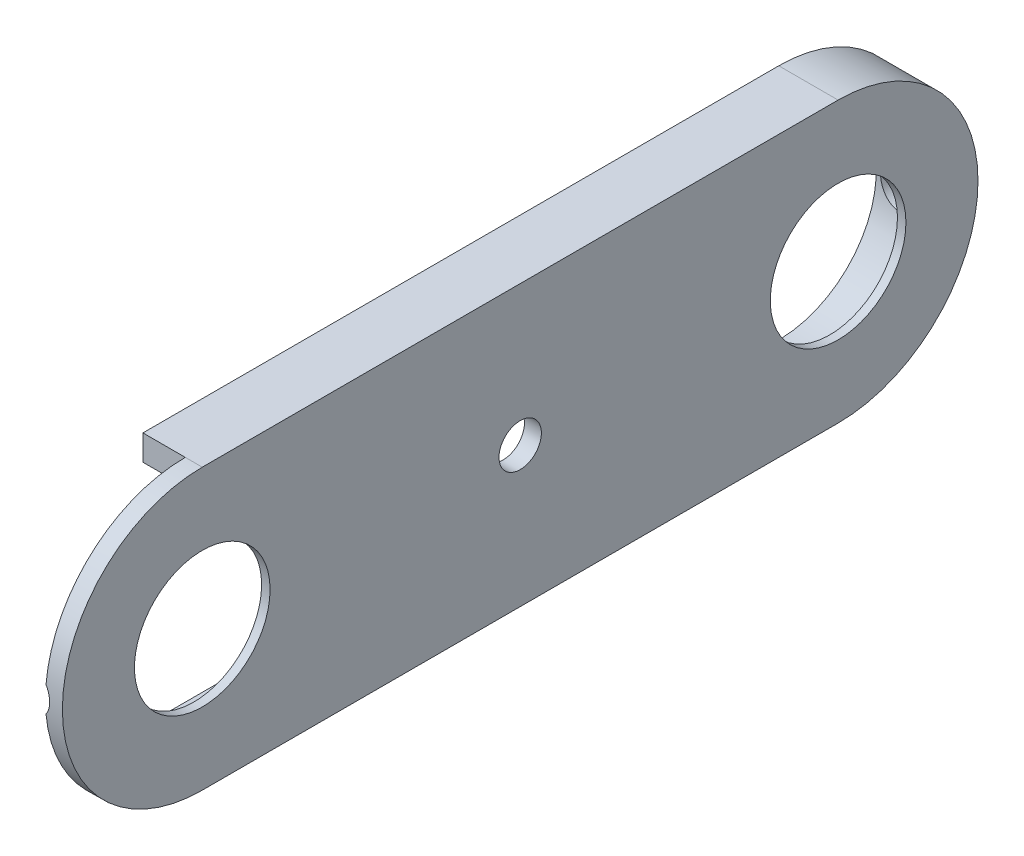
from build123d import *

# Parameters (mm, degrees)
SKETCH3_R           = 11.5
BOSS_EXTRUDE2_DEPTH = 1
BOSS_EXTRUDE3_START = 1
SKETCH4_R           = 8
BOSS_EXTRUDE3_DEPTH = 1
SKETCH5_R           = 11.5
BOSS_EXTRUDE4_DEPTH = 5
SKETCH6_R           = 2.5
CUT_EXTRUDE1_DEPTH  = 10
SKETCH7_R           = 2.5
CUT_EXTRUDE2_DEPTH  = 57.896836604
SKETCH11_W          = 5
SKETCH11_H          = 75
BOSS_EXTRUDE7_DEPTH = 3


with BuildPart() as part:
    # Sketch3 → Boss-Extrude2 (new body)
    with BuildSketch(Plane(origin=(0, 20, 0), x_dir=(0, 1, 0), z_dir=(-1, 0, 0))):
        with BuildLine():
            Line((-3.5, 37.5), (-3.5, -37.5))
            ThreePointArc((-3.5, -37.5), (-20, -54), (-36.5, -37.5))
            Line((-36.5, -37.5), (-36.5, 37.5))
            ThreePointArc((-36.5, 37.5), (-20, 54), (-3.5, 37.5))
        make_face()
        with Locations(Location((-20, -37.5, 0), (0, 0, 270))):
            Circle(SKETCH3_R, mode=Mode.SUBTRACT)
        with Locations(Location((-20, 37.5, 0), (0, 0, 270))):
            Circle(SKETCH3_R, mode=Mode.SUBTRACT)
    extrude(amount=BOSS_EXTRUDE2_DEPTH)

    # Sketch4 → Boss-Extrude3 (add)
    with BuildSketch(Plane(origin=(0, 0, 0), x_dir=(0, 0, -1), z_dir=(1, 0, 0)).offset(BOSS_EXTRUDE3_START)):
        with BuildLine():
            Line((37.5, 16.5), (-37.5, 16.5))
            ThreePointArc((-37.5, 16.5), (-54, 0), (-37.5, -16.5))
            Line((-37.5, -16.5), (37.5, -16.5))
            ThreePointArc((37.5, -16.5), (54, 0), (37.5, 16.5))
        make_face()
        with Locations((-37.5, 0)):
            Circle(SKETCH4_R, mode=Mode.SUBTRACT)
        with Locations((37.5, 0)):
            Circle(SKETCH4_R, mode=Mode.SUBTRACT)
    extrude(amount=-BOSS_EXTRUDE3_DEPTH)

    # Sketch5 → Boss-Extrude4 (add)
    with BuildSketch(Plane.ZY.offset(1)):
        with BuildLine():
            ThreePointArc((-37.5, 16.5), (-54, 0), (-37.5, -16.5))
            ThreePointArc((-37.5, -16.5), (-21, 0), (-37.5, 16.5))
        make_face()
        with Locations((-37.5, 0)):
            Circle(SKETCH5_R, mode=Mode.SUBTRACT)
    extrude(amount=BOSS_EXTRUDE4_DEPTH)

    # Sketch6 → Cut-Extrude1 (cut)
    with BuildSketch(Plane.XY.offset(54)):
        with Locations((-3, 0)):
            Circle(SKETCH6_R)
    cut_extrude1 = extrude(amount=-CUT_EXTRUDE1_DEPTH, mode=Mode.SUBTRACT)

    # Mirror1: Cut-Extrude1 across plane
    add(cut_extrude1.mirror(Plane.XY), mode=Mode.SUBTRACT)

    # Sketch7 → Cut-Extrude2 (cut, through all)
    with BuildSketch(Plane(origin=(1, 0, 0), x_dir=(0, 0, -1), z_dir=(1, 0, 0))):
        Circle(SKETCH7_R)
    extrude(amount=-CUT_EXTRUDE2_DEPTH, mode=Mode.SUBTRACT)

    # Sketch11 → Boss-Extrude7 (add)
    with BuildSketch(Plane.XZ.offset(16.5)):
        with Locations((-3.5, 0)):
            Rectangle(SKETCH11_W, SKETCH11_H)
    boss_extrude7 = extrude(amount=-BOSS_EXTRUDE7_DEPTH)

    # Mirror2: Boss-Extrude7 across plane
    add(boss_extrude7.mirror(Plane.ZX))


solid = part.part
